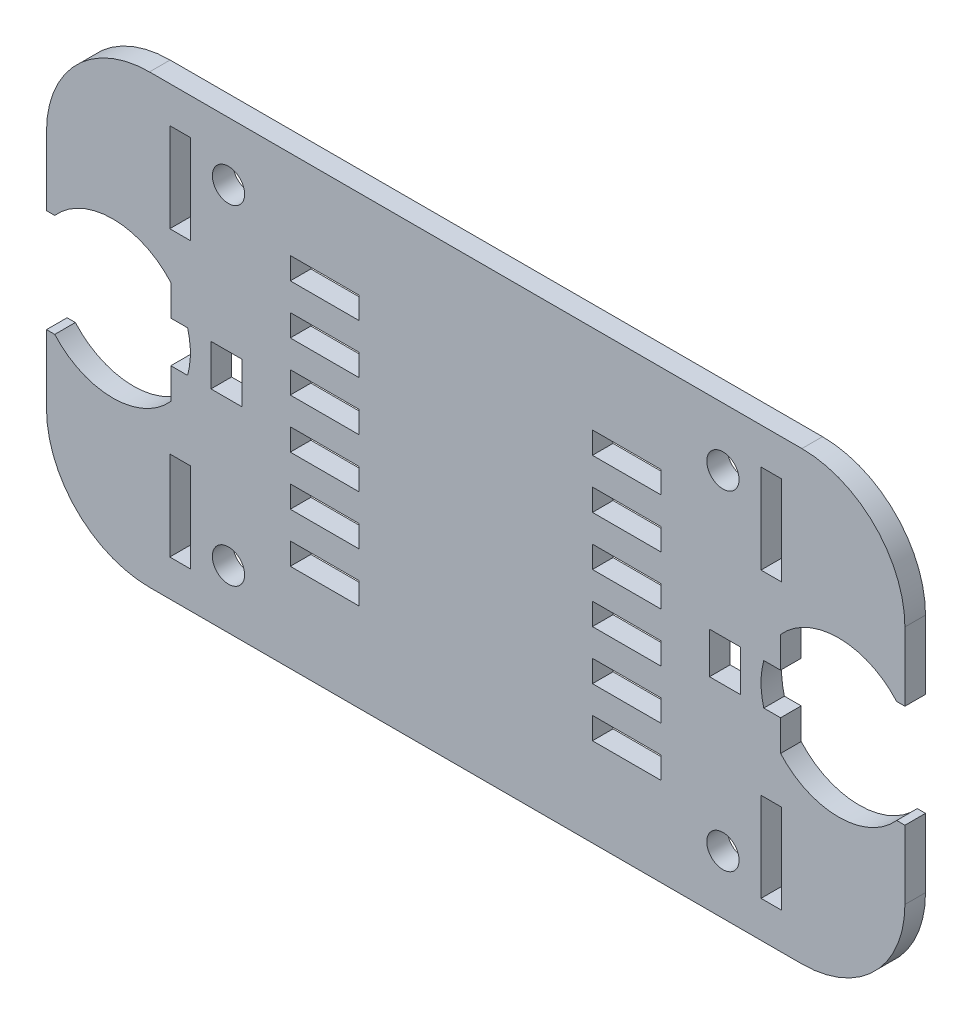
from build123d import *

# Parameters (mm, degrees)
SKICA2_R                = 2.35
SKICA2_W                = 4.5
SKICA2_H                = 6
SKICA2_W_2              = 3
SKICA2_H_2              = 13
SKICA2_W_3              = 10
SKICA2_H_3              = 3.2
P_IDAT_VYSUNUT_M1_DEPTH = 3
ZAOBLIT1_R              = 15


with BuildPart() as part:
    # Skica2 → Přidat vysunutím1 (new body)
    with BuildSketch(Plane.XY):
        with BuildLine():
            Line((-62.5, 7.5), (-61.3, 7.5))
            ThreePointArc((-61.3, 7.5), (-52.847781356, 11.3), (-44.395562713, 7.5))
            Line((-44.395562713, 7.5), (-44.395562713, 3))
            Line((-44.395562713, 3), (-41.953287334, 3))
            ThreePointArc((-41.953287334, 3), (-41.547781356, 0), (-41.953287334, -3))
            Line((-41.953287334, -3), (-44.395562713, -3))
            Line((-44.395562713, -3), (-44.395562713, -7.5))
            ThreePointArc((-44.395562713, -7.5), (-52.847781356, -11.3), (-61.3, -7.5))
            Line((-61.3, -7.5), (-62.5, -7.5))
            Line((-62.5, -7.5), (-62.5, -32.5))
            Line((-62.5, -32.5), (62.5, -32.5))
            Line((62.5, -32.5), (62.5, -7.5))
            Line((62.5, -7.5), (61.3, -7.5))
            ThreePointArc((61.3, -7.5), (52.847781356, -11.3), (44.395562713, -7.5))
            Line((44.395562713, -7.5), (44.395562713, -3))
            Line((44.395562713, -3), (41.953287334, -3))
            ThreePointArc((41.953287334, -3), (41.547781356, 0), (41.953287334, 3))
            Line((41.953287334, 3), (44.395562713, 3))
            Line((44.395562713, 3), (44.395562713, 7.5))
            ThreePointArc((44.395562713, 7.5), (52.847781356, 11.3), (61.3, 7.5))
            Line((61.3, 7.5), (62.5, 7.5))
            Line((62.5, 7.5), (62.5, 32.5))
            Line((62.5, 32.5), (-62.5, 32.5))
            Line((-62.5, 32.5), (-62.5, 7.5))
        make_face()
        with Locations((-36, 24)):
            Circle(SKICA2_R, mode=Mode.SUBTRACT)
        with Locations((36, 24)):
            Circle(SKICA2_R, mode=Mode.SUBTRACT)
        with Locations((-36, -24)):
            Circle(SKICA2_R, mode=Mode.SUBTRACT)
        with Locations((36, -24)):
            Circle(SKICA2_R, mode=Mode.SUBTRACT)
        with Locations((-36.297781356, 0)):
            Rectangle(SKICA2_W, SKICA2_H, mode=Mode.SUBTRACT)
        with Locations((-43.047781356, -20.7)):
            Rectangle(SKICA2_W_2, SKICA2_H_2, mode=Mode.SUBTRACT)
        with Locations((-43.047781356, 20.7)):
            Rectangle(SKICA2_W_2, SKICA2_H_2, mode=Mode.SUBTRACT)
        with Locations((43.047781356, -20.7)):
            Rectangle(SKICA2_W_2, SKICA2_H_2, mode=Mode.SUBTRACT)
        with Locations((43.047781356, 20.7)):
            Rectangle(SKICA2_W_2, SKICA2_H_2, mode=Mode.SUBTRACT)
        with Locations((36.297781356, 0)):
            Rectangle(SKICA2_W, SKICA2_H, mode=Mode.SUBTRACT)
        with Locations((-22, 18)):
            Rectangle(SKICA2_W_3, SKICA2_H_3, mode=Mode.SUBTRACT)
        with Locations((-22, 10.8)):
            Rectangle(SKICA2_W_3, SKICA2_H_3, mode=Mode.SUBTRACT)
        with Locations((-22, 3.6)):
            Rectangle(SKICA2_W_3, SKICA2_H_3, mode=Mode.SUBTRACT)
        with Locations((-22, -3.6)):
            Rectangle(SKICA2_W_3, SKICA2_H_3, mode=Mode.SUBTRACT)
        with Locations((-22, -10.8)):
            Rectangle(SKICA2_W_3, SKICA2_H_3, mode=Mode.SUBTRACT)
        with Locations((-22, -18)):
            Rectangle(SKICA2_W_3, SKICA2_H_3, mode=Mode.SUBTRACT)
        with Locations((22, -18)):
            Rectangle(SKICA2_W_3, SKICA2_H_3, mode=Mode.SUBTRACT)
        with Locations((22, -10.8)):
            Rectangle(SKICA2_W_3, SKICA2_H_3, mode=Mode.SUBTRACT)
        with Locations((22, -3.6)):
            Rectangle(SKICA2_W_3, SKICA2_H_3, mode=Mode.SUBTRACT)
        with Locations((22, 3.6)):
            Rectangle(SKICA2_W_3, SKICA2_H_3, mode=Mode.SUBTRACT)
        with Locations((22, 10.8)):
            Rectangle(SKICA2_W_3, SKICA2_H_3, mode=Mode.SUBTRACT)
        with Locations((22, 18)):
            Rectangle(SKICA2_W_3, SKICA2_H_3, mode=Mode.SUBTRACT)
    extrude(amount=P_IDAT_VYSUNUT_M1_DEPTH)

    # Zaoblit1
    zaoblit1_edges = [part.edges().sort_by_distance(p)[0] for p in [
        (-62.5, 32.5, 1.5),
        (62.5, 32.5, 1.5),
        (62.5, -32.5, 1.5),
        (-62.5, -32.5, 1.5),
    ]]
    fillet(zaoblit1_edges, radius=ZAOBLIT1_R)


solid = part.part
